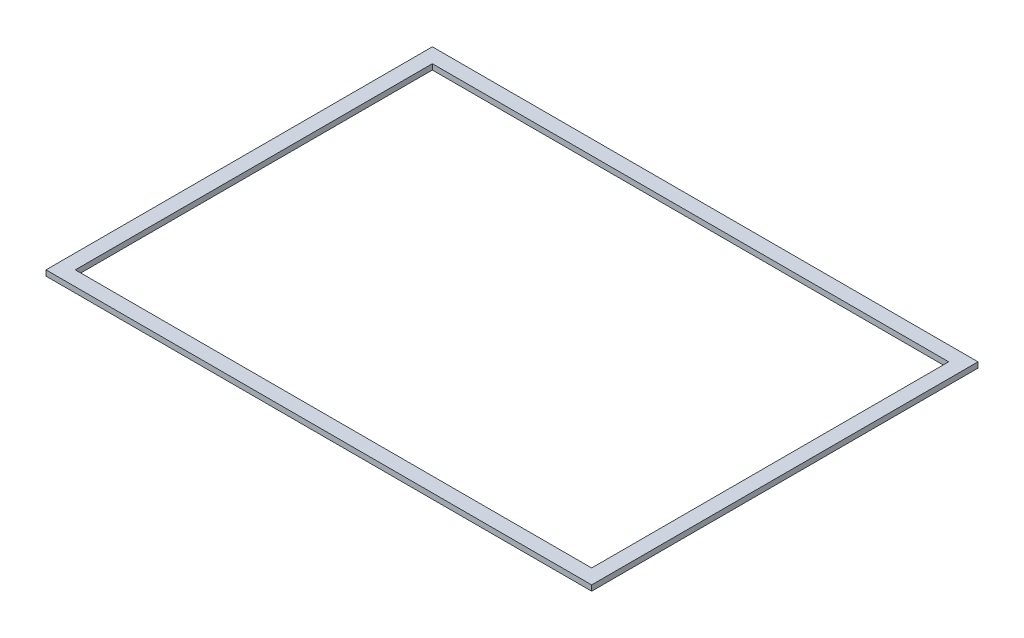
from build123d import *

# Parameters (mm, degrees)
SKETCH2_W      = 298
SKETCH2_H      = 211
SKETCH2_W_2    = 282
SKETCH2_H_2    = 195
EXTRUDE1_DEPTH = 3


with BuildPart() as part:
    # Sketch2 → Extrude1 (new body)
    with BuildSketch(Plane(origin=(0, 0, 0), x_dir=(1, 0, 0), z_dir=(0, 1, 0))):
        Rectangle(SKETCH2_W, SKETCH2_H)
        Rectangle(SKETCH2_W_2, SKETCH2_H_2, mode=Mode.SUBTRACT)
    extrude(amount=EXTRUDE1_DEPTH)


solid = part.part
